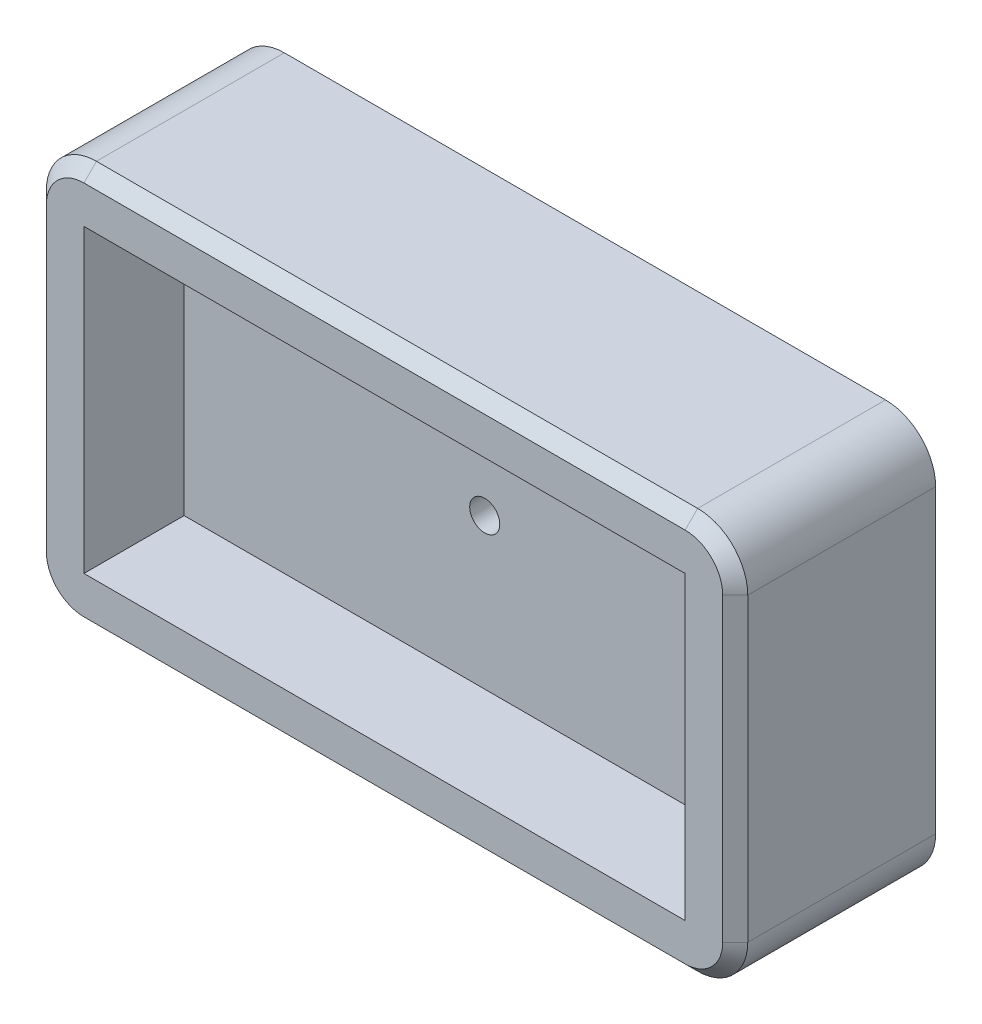
from build123d import *

# Parameters (mm, degrees)
BOSS_EXTRUDE1_DEPTH = 12.7
BOSS_EXTRUDE2_START = 12.7
SKETCH2_3_W         = 76.2
SKETCH2_3_H         = 38.1
BOSS_EXTRUDE2_DEPTH = 12.7
CHAMFER1_SIZE       = 1.5875
SKETCH3_R           = 1.905
CUT_EXTRUDE1_DEPTH  = 58.15


with BuildPart() as part:
    # Sketch2 → Boss-Extrude1 (new body)
    with BuildSketch(Plane.XY):
        with BuildLine():
            Line((38.1, 25.4), (-38.1, 25.4))
            ThreePointArc((-38.1, 25.4), (-42.590128061, 23.540128061), (-44.45, 19.05))
            Line((-44.45, 19.05), (-44.45, -19.05))
            ThreePointArc((-44.45, -19.05), (-42.590128061, -23.540128061), (-38.1, -25.4))
            Line((-38.1, -25.4), (38.1, -25.4))
            ThreePointArc((38.1, -25.4), (42.590128061, -23.540128061), (44.45, -19.05))
            Line((44.45, -19.05), (44.45, 19.05))
            ThreePointArc((44.45, 19.05), (42.590128061, 23.540128061), (38.1, 25.4))
        make_face()
    extrude(amount=-BOSS_EXTRUDE1_DEPTH)

    # Sketch2<3> → Boss-Extrude2 (add)
    with BuildSketch(Plane.XY.offset(BOSS_EXTRUDE2_START)):
        with BuildLine():
            Line((-38.1, 25.4), (38.1, 25.4))
            ThreePointArc((38.1, 25.4), (42.590128061, 23.540128061), (44.45, 19.05))
            Line((44.45, 19.05), (44.45, -19.05))
            ThreePointArc((44.45, -19.05), (42.590128061, -23.540128061), (38.1, -25.4))
            Line((38.1, -25.4), (-38.1, -25.4))
            ThreePointArc((-38.1, -25.4), (-42.590128061, -23.540128061), (-44.45, -19.05))
            Line((-44.45, -19.05), (-44.45, 19.05))
            ThreePointArc((-44.45, 19.05), (-42.590128061, 23.540128061), (-38.1, 25.4))
        make_face()
        Rectangle(SKETCH2_3_W, SKETCH2_3_H, mode=Mode.SUBTRACT)
    extrude(amount=-BOSS_EXTRUDE2_DEPTH)

    # Chamfer1
    chamfer1_edges = [part.edges().sort_by_distance(p)[0] for p in [
        (44.45, 0, 12.7),
        (42.590128061, 23.540128061, 12.7),
        (42.590128061, -23.540128061, 12.7),
        (0, 25.4, 12.7),
        (0, -25.4, 12.7),
        (-42.590128061, 23.540128061, 12.7),
        (-42.590128061, -23.540128061, 12.7),
        (-44.45, 0, 12.7),
    ]]
    chamfer(chamfer1_edges, length=CHAMFER1_SIZE)

    # Sketch3 → Cut-Extrude1 (cut, through all)
    with BuildSketch(Plane(origin=(0, 0, -12.7), x_dir=(-1, 0, 0), z_dir=(0, 0, -1))):
        Circle(SKETCH3_R)
    extrude(amount=-CUT_EXTRUDE1_DEPTH, mode=Mode.SUBTRACT)


solid = part.part
